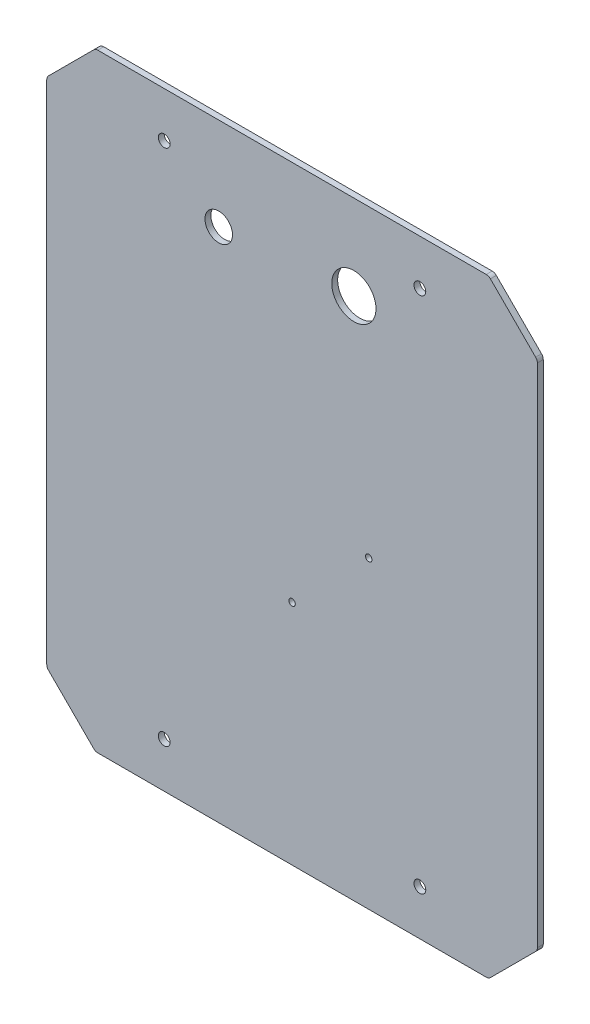
from build123d import *

# Parameters (mm, degrees)
BASE_DEPTH              = 3
CONG_1_R                = 3
ESQUISSE20_R            = 3
PERCAGE_PROFIL_S_DEPTH  = 383.50448595
ESQUISSE21_R            = 1.65
PERCAGE_LIDAR_DEPTH     = 383.50448595
ESQUISSE22_R            = 11.25
ENL_V_MAT_EXTRU_3_DEPTH = 383.50448595
ESQUISSE23_R            = 7
ENL_V_MAT_EXTRU_4_DEPTH = 383.50448595


with BuildPart() as part:
    # Esquisse1 → Base (new body)
    with BuildSketch(Plane.XY):
        Polygon((0, 0), (-200, 0), (-224.748737342, 24.748737342), (-224.748737342, 284.748737342), (-200, 309.497474683), (0, 309.497474683), (24.748737342, 284.748737342), (24.748737342, 24.748737342), align=None)
    extrude(amount=BASE_DEPTH)

    # Congé1
    cong_1_edges = [part.edges().sort_by_distance(p)[0] for p in [
        (0, 0, 1.5),
        (-200, 0, 1.5),
        (-224.748737342, 24.748737342, 1.5),
        (-224.748737342, 284.748737342, 1.5),
        (-200, 309.497474683, 1.5),
        (0, 309.497474683, 1.5),
        (24.748737342, 284.748737342, 1.5),
        (24.748737342, 24.748737342, 1.5),
    ]]
    fillet(cong_1_edges, radius=CONG_1_R)

    # Esquisse20 → Percage Profilés (cut, through all)
    with BuildSketch(Plane(origin=(0, 0, 0), x_dir=(-1, 0, 0), z_dir=(0, 0, -1))):
        with Locations((35, 286.497474683)):
            Circle(ESQUISSE20_R)
        with Locations(Location((165, 286.497474683, 0), (0, 0, 180))):
            Circle(ESQUISSE20_R)
        with Locations((165, 23)):
            Circle(ESQUISSE20_R)
        with Locations(Location((35, 23, 0), (0, 0, 180))):
            Circle(ESQUISSE20_R)
    extrude(amount=-PERCAGE_PROFIL_S_DEPTH, mode=Mode.SUBTRACT)

    # Esquisse21 → Percage Lidar (cut, through all)
    with BuildSketch(Plane(origin=(0, 0, 0), x_dir=(-1, 0, 0), z_dir=(0, 0, -1))):
        with Locations((61, 154.748737342)):
            Circle(ESQUISSE21_R)
        with Locations((100, 115.748737342)):
            Circle(ESQUISSE21_R)
    extrude(amount=-PERCAGE_LIDAR_DEPTH, mode=Mode.SUBTRACT)

    # Esquisse22 → Enlèv. mat.-Extru.3 (cut, through all)
    with BuildSketch(Plane(origin=(0, 0, 0), x_dir=(-1, 0, 0), z_dir=(0, 0, -1))):
        with Locations((68.560025138, 266.317142531)):
            Circle(ESQUISSE22_R)
    extrude(amount=-ENL_V_MAT_EXTRU_3_DEPTH, mode=Mode.SUBTRACT)

    # Esquisse23 → Enlèv. mat.-Extru.4 (cut, through all)
    with BuildSketch(Plane(origin=(0, 0, 0), x_dir=(-1, 0, 0), z_dir=(0, 0, -1))):
        with Locations((137.282259715, 262.406498542)):
            Circle(ESQUISSE23_R)
    extrude(amount=-ENL_V_MAT_EXTRU_4_DEPTH, mode=Mode.SUBTRACT)


solid = part.part
